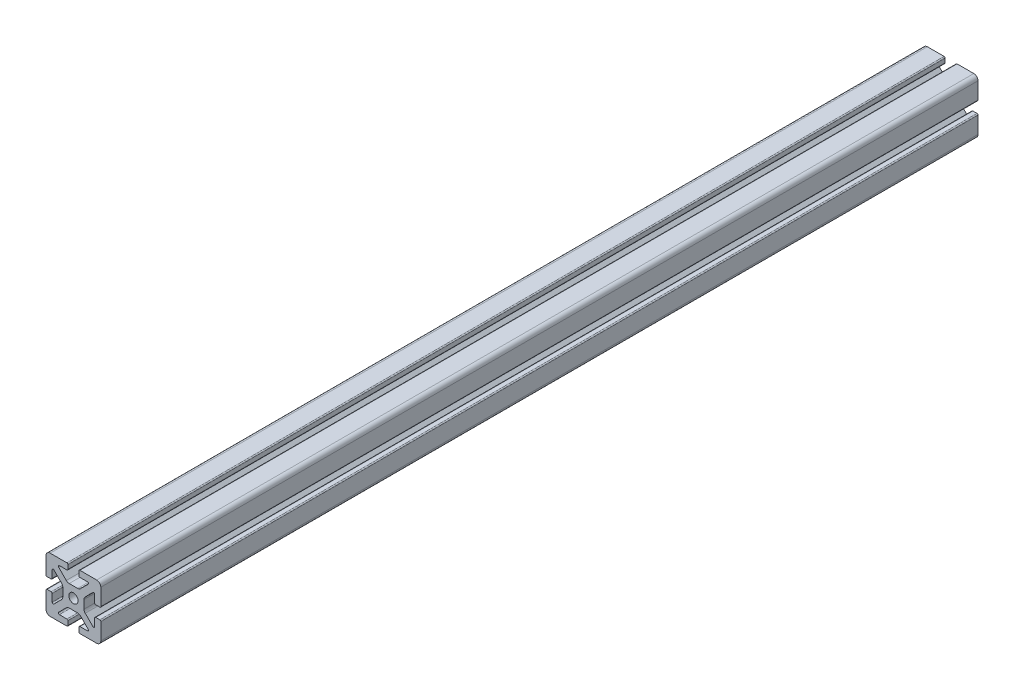
from build123d import *

# Parameters (mm, degrees)
SKETCH1_R           = 3.4036
BOSS_EXTRUDE1_DEPTH = 320


with BuildPart() as part:
    # Sketch1 → Boss-Extrude1 (new, symmetric)
    with BuildSketch(Plane.XY):
        with BuildLine():
            Line((-20, 16.952), (-20, 4.7625))
            ThreePointArc((-20, 4.7625), (-19.776815367, 4.223684633), (-19.238, 4.0005))
            Line((-19.238, 4.0005), (-16.2662, 4.0005))
            ThreePointArc((-16.2662, 4.0005), (-15.727384633, 4.223684633), (-15.5042, 4.7625))
            Line((-15.5042, 4.7625), (-15.5042, 10.2235))
            ThreePointArc((-15.5042, 10.2235), (-15.033804775, 10.927496204), (-14.203384633, 10.762315367))
            Line((-14.203384633, 10.762315367), (-8.635059555, 5.19399029))
            ThreePointArc((-8.635059555, 5.19399029), (-7.985348265, 4.221628629), (-7.7572, 3.074649845))
            Line((-7.7572, 3.074649845), (-7.7572, -3.074649845))
            ThreePointArc((-7.7572, -3.074649845), (-7.985348265, -4.221628629), (-8.635059555, -5.19399029))
            Line((-8.635059555, -5.19399029), (-14.203384633, -10.762315367))
            ThreePointArc((-14.203384633, -10.762315367), (-15.033804775, -10.927496204), (-15.5042, -10.2235))
            Line((-15.5042, -10.2235), (-15.5042, -4.7625))
            ThreePointArc((-15.5042, -4.7625), (-15.727384633, -4.223684633), (-16.2662, -4.0005))
            Line((-16.2662, -4.0005), (-19.238, -4.0005))
            ThreePointArc((-19.238, -4.0005), (-19.776815367, -4.223684633), (-20, -4.7625))
            Line((-20, -4.7625), (-20, -16.952))
            ThreePointArc((-20, -16.952), (-19.107261469, -19.107261469), (-16.952, -20))
            Line((-16.952, -20), (-4.7625, -20))
            ThreePointArc((-4.7625, -20), (-4.223684633, -19.776815367), (-4.0005, -19.238))
            Line((-4.0005, -19.238), (-4.0005, -16.2662))
            ThreePointArc((-4.0005, -16.2662), (-4.223684633, -15.727384633), (-4.7625, -15.5042))
            Line((-4.7625, -15.5042), (-10.2235, -15.5042))
            ThreePointArc((-10.2235, -15.5042), (-10.927496204, -15.033804775), (-10.762315367, -14.203384633))
            Line((-10.762315367, -14.203384633), (-5.19399029, -8.635059555))
            ThreePointArc((-5.19399029, -8.635059555), (-4.221628629, -7.985348265), (-3.074649845, -7.7572))
            Line((-3.074649845, -7.7572), (3.074649845, -7.7572))
            ThreePointArc((3.074649845, -7.7572), (4.221628629, -7.985348265), (5.19399029, -8.635059555))
            Line((5.19399029, -8.635059555), (10.762315367, -14.203384633))
            ThreePointArc((10.762315367, -14.203384633), (10.927496204, -15.033804775), (10.2235, -15.5042))
            Line((10.2235, -15.5042), (4.7625, -15.5042))
            ThreePointArc((4.7625, -15.5042), (4.223684633, -15.727384633), (4.0005, -16.2662))
            Line((4.0005, -16.2662), (4.0005, -19.238))
            ThreePointArc((4.0005, -19.238), (4.223684633, -19.776815367), (4.7625, -20))
            Line((4.7625, -20), (16.952, -20))
            ThreePointArc((16.952, -20), (19.107261469, -19.107261469), (20, -16.952))
            Line((20, -16.952), (20, -4.7625))
            ThreePointArc((20, -4.7625), (19.776815367, -4.223684633), (19.238, -4.0005))
            Line((19.238, -4.0005), (16.2662, -4.0005))
            ThreePointArc((16.2662, -4.0005), (15.727384633, -4.223684633), (15.5042, -4.7625))
            Line((15.5042, -4.7625), (15.5042, -10.2235))
            ThreePointArc((15.5042, -10.2235), (15.033804775, -10.927496204), (14.203384633, -10.762315367))
            Line((14.203384633, -10.762315367), (8.635059555, -5.19399029))
            ThreePointArc((8.635059555, -5.19399029), (7.985348265, -4.221628629), (7.7572, -3.074649845))
            Line((7.7572, -3.074649845), (7.7572, 3.074649845))
            ThreePointArc((7.7572, 3.074649845), (7.985348265, 4.221628629), (8.635059555, 5.19399029))
            Line((8.635059555, 5.19399029), (14.203384633, 10.762315367))
            ThreePointArc((14.203384633, 10.762315367), (15.033804775, 10.927496204), (15.5042, 10.2235))
            Line((15.5042, 10.2235), (15.5042, 4.7625))
            ThreePointArc((15.5042, 4.7625), (15.727384633, 4.223684633), (16.2662, 4.0005))
            Line((16.2662, 4.0005), (19.238, 4.0005))
            ThreePointArc((19.238, 4.0005), (19.776815367, 4.223684633), (20, 4.7625))
            Line((20, 4.7625), (20, 16.952))
            ThreePointArc((20, 16.952), (19.107261469, 19.107261469), (16.952, 20))
            Line((16.952, 20), (4.7625, 20))
            ThreePointArc((4.7625, 20), (4.223684633, 19.776815367), (4.0005, 19.238))
            Line((4.0005, 19.238), (4.0005, 16.2662))
            ThreePointArc((4.0005, 16.2662), (4.223684633, 15.727384633), (4.7625, 15.5042))
            Line((4.7625, 15.5042), (10.2235, 15.5042))
            ThreePointArc((10.2235, 15.5042), (10.927496204, 15.033804775), (10.762315367, 14.203384633))
            Line((10.762315367, 14.203384633), (5.19399029, 8.635059555))
            ThreePointArc((5.19399029, 8.635059555), (4.221628629, 7.985348265), (3.074649845, 7.7572))
            Line((3.074649845, 7.7572), (-3.074649845, 7.7572))
            ThreePointArc((-3.074649845, 7.7572), (-4.221628629, 7.985348265), (-5.19399029, 8.635059555))
            Line((-5.19399029, 8.635059555), (-10.762315367, 14.203384633))
            ThreePointArc((-10.762315367, 14.203384633), (-10.927496204, 15.033804775), (-10.2235, 15.5042))
            Line((-10.2235, 15.5042), (-4.7625, 15.5042))
            ThreePointArc((-4.7625, 15.5042), (-4.223684633, 15.727384633), (-4.0005, 16.2662))
            Line((-4.0005, 16.2662), (-4.0005, 19.238))
            ThreePointArc((-4.0005, 19.238), (-4.223684633, 19.776815367), (-4.7625, 20))
            Line((-4.7625, 20), (-16.952, 20))
            ThreePointArc((-16.952, 20), (-19.107261469, 19.107261469), (-20, 16.952))
        make_face()
        Circle(SKETCH1_R, mode=Mode.SUBTRACT)
    extrude(amount=BOSS_EXTRUDE1_DEPTH, both=True)


solid = part.part
